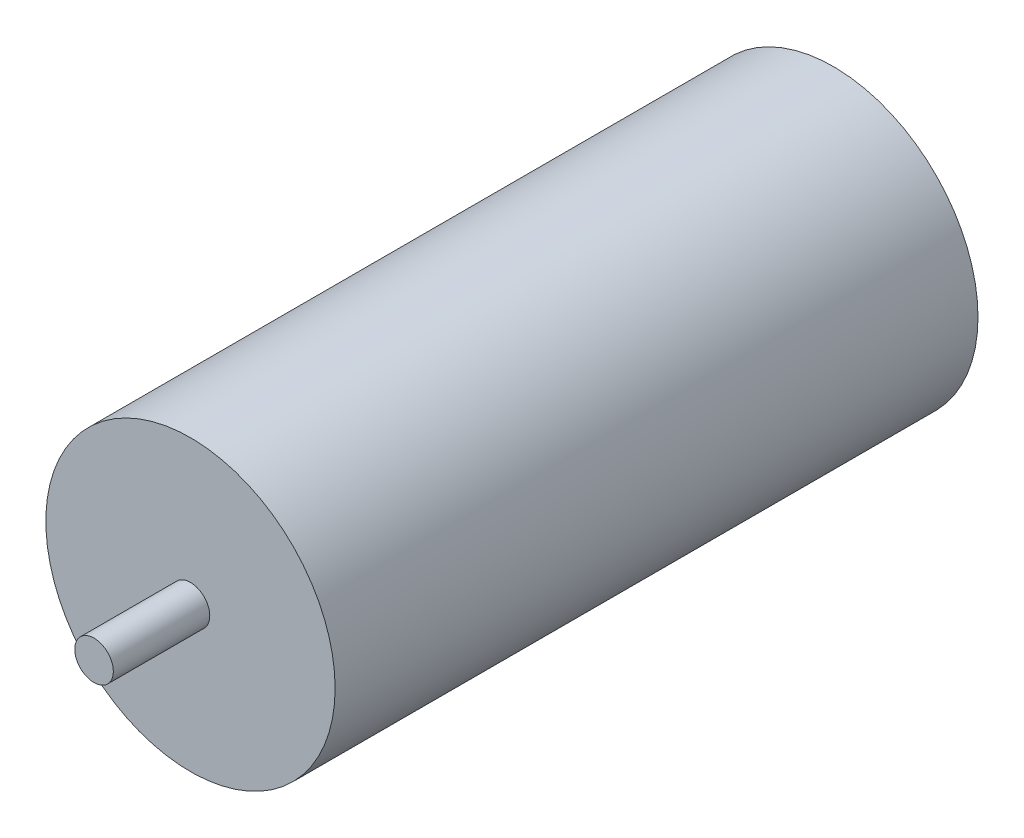
from build123d import *

# Parameters (mm, degrees)
SKETCH1_R           = 22.5
BOSS_EXTRUDE1_DEPTH = 100
SKETCH2_R           = 3
BOSS_EXTRUDE2_DEPTH = 15


with BuildPart() as part:
    # Sketch1 → Boss-Extrude1 (new body)
    with BuildSketch(Plane.XY):
        Circle(SKETCH1_R)
    extrude(amount=BOSS_EXTRUDE1_DEPTH)

    # Sketch2 → Boss-Extrude2 (add)
    with BuildSketch(Plane.XY.offset(100)):
        Circle(SKETCH2_R)
    extrude(amount=BOSS_EXTRUDE2_DEPTH)


solid = part.part
